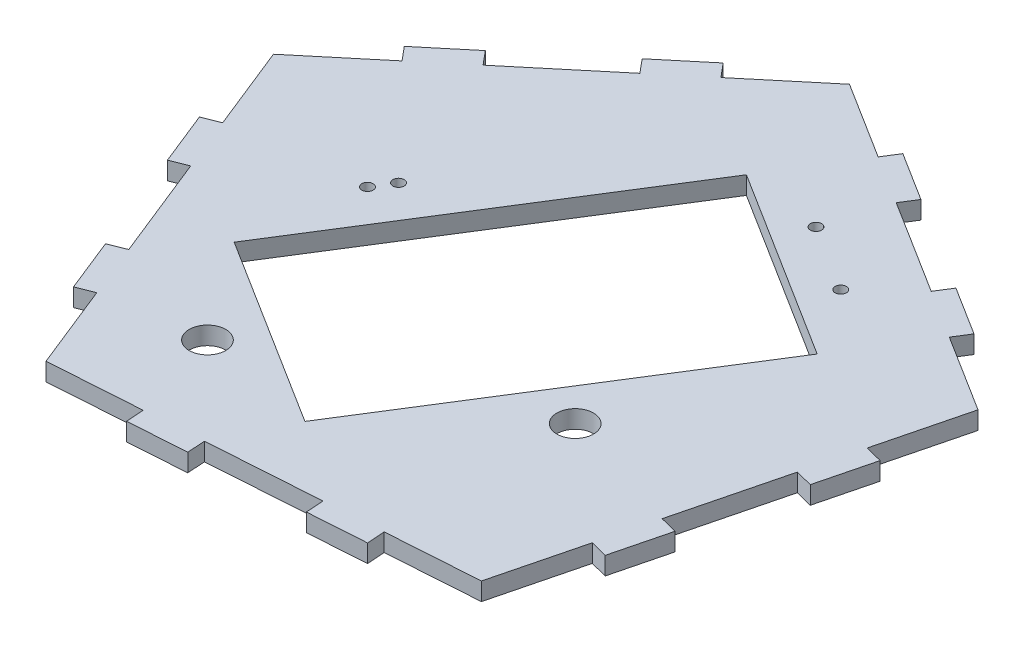
from build123d import *

# Parameters (mm, degrees)
BOSS_EXTRUDE1_DEPTH = 3.18
SKETCH4_R           = 3.25
TOP_CUT_DEPTH       = 10
SKETCH7_R           = 1
TOP_CUT_2_DEPTH     = 87.044973388
SKETCH10_R          = 1
TOP_CUT_3_DEPTH     = 10
EXTRUDE_M_DEPTH     = 3.18
CIRCLE_M_COUNT      = 5


with BuildPart() as part:
    # Sketch1 → Boss-Extrude1 (new body)
    with BuildSketch(Plane(origin=(0, 0, 0), x_dir=(1, 0, 0), z_dir=(0, 1, 0))):
        Polygon((-59.925822748, 15.118064705), (-32.896231583, -52.321105303), (39.594833528, -47.454286112), (57.367184482, 22.992743574), (-4.139963679, 61.664583135), align=None)
    extrude(amount=BOSS_EXTRUDE1_DEPTH)

    # Sketch4 → Top Cut (cut)
    with BuildSketch(Plane(origin=(0, 3.18, 0), x_dir=(1, 0, 0), z_dir=(0, 1, 0))):
        with Locations(Location((-21.823160529, -34.709503951, 0), (0, 0, 270))):
            Circle(SKETCH4_R)
        with Locations(Location((23.704051479, -14.903621825, 0), (0, 0, 270))):
            Circle(SKETCH4_R)
        Polygon((-34.496448207, -17.291473653), (0.633517523, 38.582361975), (34.496448207, 17.291473653), (-0.633517523, -38.582361975), align=None)
    extrude(amount=-TOP_CUT_DEPTH, mode=Mode.SUBTRACT)

    # Sketch7 → Top Cut 2 (cut, through all)
    with BuildSketch(Plane(origin=(0, 3.18, 0), x_dir=(1, 0, 0), z_dir=(0, 1, 0))):
        with Locations(Location((-29.026773559, 6.437889154, 0), (0, 0, 270))):
            Circle(SKETCH7_R)
        with Locations(Location((-31.155862391, 3.051596086, 0), (0, 0, 270))):
            Circle(SKETCH7_R)
    extrude(amount=-TOP_CUT_2_DEPTH, mode=Mode.SUBTRACT)

    # Sketch10 → Top Cut 3 (cut)
    with BuildSketch(Plane(origin=(0, 3.18, 0), x_dir=(1, 0, 0), z_dir=(0, 1, 0))):
        with Locations(Location((14.832603244, 36.742262873, 0), (0, 0, 270))):
            Circle(SKETCH10_R)
        with Locations(Location((26.684628983, 29.29045196, 0), (0, 0, 270))):
            Circle(SKETCH10_R)
    extrude(amount=-TOP_CUT_3_DEPTH, mode=Mode.SUBTRACT)

    # Sketch3 → Extrude M (add)
    with BuildSketch(Plane(origin=(0, 3.18, 0), x_dir=(1, 0, 0), z_dir=(0, 1, 0))):
        Polygon((-49.511175703, 27.949382471), (-45.436591686, 23.066006068), (-37.589405077, 29.613529441), (-41.663989094, 34.496905844), align=None)
        Polygon((-26.476381351, 47.169118399), (-22.401797334, 42.285741997), (-14.554610725, 48.83326537), (-18.629194741, 53.716641772), align=None)
    extrude_m = extrude(amount=-EXTRUDE_M_DEPTH)

    # Circle M: Extrude M ×5 about axis
    circle_m_axis = Axis((0, 0, 0), (0, 1, 0))
    for i in range(1, CIRCLE_M_COUNT):
        add(extrude_m.rotate(circle_m_axis, i * 360 / CIRCLE_M_COUNT))


solid = part.part
